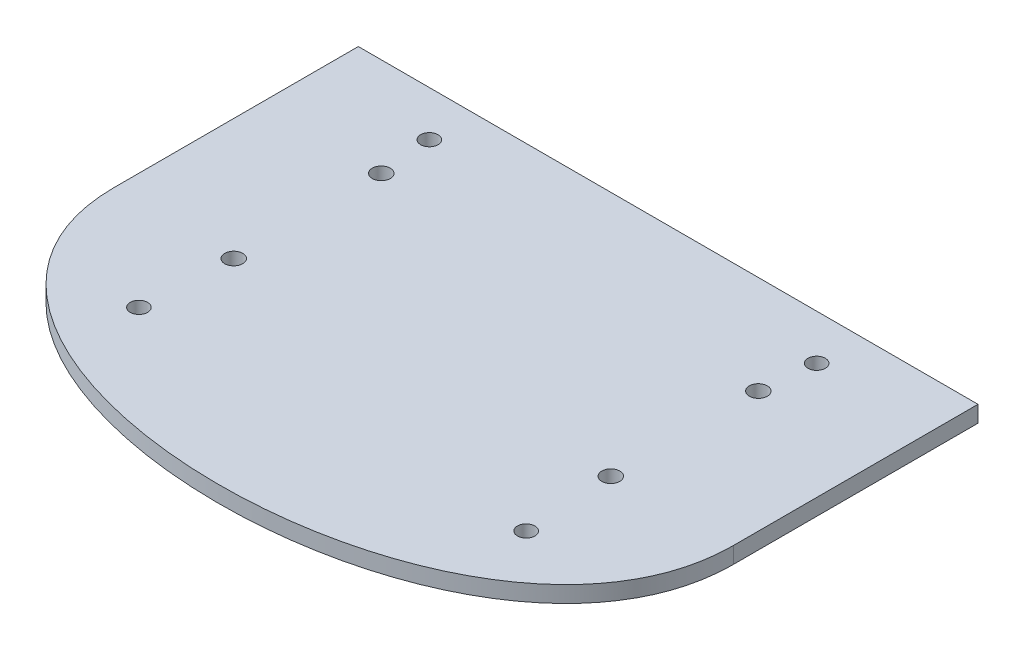
from build123d import *

# Parameters (mm, degrees)
BOSS_EXTRUDE1_DEPTH     = 2.54
CUT_EXTRUDE1_DEPTH      = 60.34583774
CUT_EXTRUDE1_DEPTH_BACK = 60.34583774
SKETCH3_R               = 1.35
SKETCH3_R_2             = 1.397


with BuildPart() as part:
    # Sketch2 → Boss-Extrude1 (new body)
    with BuildSketch(Plane(origin=(0, 0, 0), x_dir=(1, 0, 0), z_dir=(0, 1, 0))):
        with BuildLine():
            Line((48.006, 34.798), (-48.006, 34.798))
            Line((-48.006, 34.798), (-48.006, -3.048))
            add(Edge.make_bspline(
                [(-48.006, -3.048), (-48.006, -45.381333333), (48.006, -45.381333333), (48.006, -3.048)],
                knots=[0, 0, 0, 0, 1, 1, 1, 1], degree=3))
            Line((48.006, -3.048), (48.006, 34.798))
        make_face()
    extrude(amount=BOSS_EXTRUDE1_DEPTH)

    # Sketch3 → Cut-Extrude1 (cut, two sides: drawn at the far end of the back side and taken through both)
    with BuildSketch(Plane(origin=(0, 2.54, 0), x_dir=(1, 0, 0), z_dir=(0, 1, 0)).offset(-CUT_EXTRUDE1_DEPTH_BACK)):
        with Locations(Location((-30, 27.798, 0), (0, 0, 270))):
            Circle(SKETCH3_R)
        with Locations(Location((-30, -17.202, 0), (0, 0, 270))):
            Circle(SKETCH3_R)
        with Locations(Location((30, -17.202, 0), (0, 0, 90))):
            Circle(SKETCH3_R)
        with Locations(Location((30, 27.798, 0), (0, 0, 90))):
            Circle(SKETCH3_R)
        with Locations(Location((-29.21, 19.558, 0), (0, 0, 270))):
            Circle(SKETCH3_R_2)
        with Locations(Location((-29.21, -3.302, 0), (0, 0, 270))):
            Circle(SKETCH3_R_2)
        with Locations(Location((29.21, -3.302, 0), (0, 0, 90))):
            Circle(SKETCH3_R_2)
        with Locations(Location((29.21, 19.558, 0), (0, 0, 90))):
            Circle(SKETCH3_R_2)
    extrude(amount=CUT_EXTRUDE1_DEPTH + CUT_EXTRUDE1_DEPTH_BACK, mode=Mode.SUBTRACT)


solid = part.part
